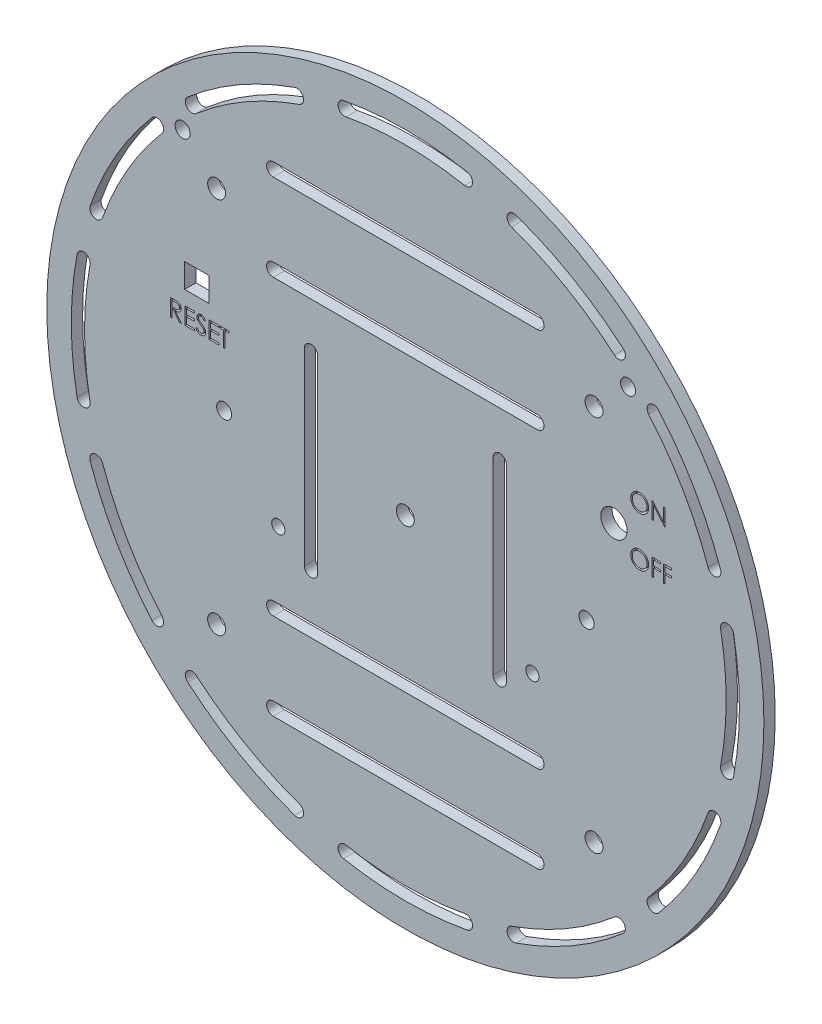
from build123d import *

# Parameters (mm, degrees)
CROQUIS1_R              = 2
CROQUIS1_R_2            = 2.375
CROQUIS1_R_3            = 3.5
CROQUIS1_R_4            = 1.75
CROQUIS1_W              = 6.4
CROQUIS1_H              = 6.4
SALIENTE_EXTRUIR1_DEPTH = 3
CORTAR_EXTRUIR2_DEPTH   = 2


with BuildPart() as part:
    # Croquis1 → Saliente-Extruir1 (new body)
    with BuildSketch(Plane.XY):
        with BuildLine():
            ThreePointArc((-73.654599313, -60), (0, -95), (73.654599313, -60))
            ThreePointArc((73.654599313, -60), (91.058534397, -27.080312284), (94.472218138, 10))
            ThreePointArc((94.472218138, 10), (0, 95), (-94.472218138, 10))
            ThreePointArc((-94.472218138, 10), (-91.058534397, -27.080312284), (-73.654599313, -60))
        make_face()
        with Locations((-59, 59)):
            Circle(CROQUIS1_R, mode=Mode.SUBTRACT)
        with Locations((-50, 50)):
            Circle(CROQUIS1_R_2, mode=Mode.SUBTRACT)
        with Locations(Location((-50, -50, 0), (0, 0, 180))):
            Circle(CROQUIS1_R_2, mode=Mode.SUBTRACT)
        with Locations((50, -50)):
            Circle(CROQUIS1_R_2, mode=Mode.SUBTRACT)
        with Locations(Location((50, 50, 0), (0, 0, 180))):
            Circle(CROQUIS1_R_2, mode=Mode.SUBTRACT)
        with Locations((55.271786123, 25.793259912)):
            Circle(CROQUIS1_R_3, mode=Mode.SUBTRACT)
        with Locations((48, 0)):
            Circle(CROQUIS1_R, mode=Mode.SUBTRACT)
        with Locations(Location((-48, 0, 0), (0, 0, 180))):
            Circle(CROQUIS1_R, mode=Mode.SUBTRACT)
        with Locations((33.654013645, -19.430153837)):
            Circle(CROQUIS1_R_4, mode=Mode.SUBTRACT)
        with Locations((-33.654013645, -19.430153837)):
            Circle(CROQUIS1_R_4, mode=Mode.SUBTRACT)
        Circle(CROQUIS1_R_2, mode=Mode.SUBTRACT)
        with Locations(Location((59, 59, 0), (0, 0, 180))):
            Circle(CROQUIS1_R, mode=Mode.SUBTRACT)
        with BuildLine():
            Line((25, 60.110307675), (35, 60.110307675))
            ThreePointArc((35, 60.110307675), (36.75, 61.860307675), (35, 63.610307675))
            Line((35, 63.610307675), (-35, 63.610307675))
            ThreePointArc((-35, 63.610307675), (-36.75, 61.860307675), (-35, 60.110307675))
            Line((-35, 60.110307675), (19, 60.110307675))
            Line((19, 60.110307675), (25, 60.110307675))
        make_face(mode=Mode.SUBTRACT)
        with BuildLine():
            Line((25, -40.610307675), (35, -40.610307675))
            ThreePointArc((35, -40.610307675), (36.75, -38.860307675), (35, -37.110307675))
            Line((35, -37.110307675), (-35, -37.110307675))
            ThreePointArc((-35, -37.110307675), (-36.75, -38.860307675), (-35, -40.610307675))
            Line((-35, -40.610307675), (19, -40.610307675))
            Line((19, -40.610307675), (25, -40.610307675))
        make_face(mode=Mode.SUBTRACT)
        with BuildLine():
            Line((-35, -60.110307675), (19, -60.110307675))
            Line((19, -60.110307675), (25, -60.110307675))
            Line((25, -60.110307675), (35, -60.110307675))
            ThreePointArc((35, -60.110307675), (36.75, -61.860307675), (35, -63.610307675))
            Line((35, -63.610307675), (-35, -63.610307675))
            ThreePointArc((-35, -63.610307675), (-36.75, -61.860307675), (-35, -60.110307675))
        make_face(mode=Mode.SUBTRACT)
        with BuildLine():
            Line((-26.75, -25), (-26.75, 25))
            ThreePointArc((-26.75, 25), (-25, 26.75), (-23.25, 25))
            Line((-23.25, 25), (-23.25, -25))
            ThreePointArc((-23.25, -25), (-25, -26.75), (-26.75, -25))
        make_face(mode=Mode.SUBTRACT)
        with BuildLine():
            Line((26.75, -25), (26.75, 25))
            ThreePointArc((26.75, 25), (25, 26.75), (23.25, 25))
            Line((23.25, 25), (23.25, -25))
            ThreePointArc((23.25, -25), (25, -26.75), (26.75, -25))
        make_face(mode=Mode.SUBTRACT)
        with BuildLine():
            Line((-35, 40.610307675), (19, 40.610307675))
            Line((19, 40.610307675), (25, 40.610307675))
            Line((25, 40.610307675), (35, 40.610307675))
            ThreePointArc((35, 40.610307675), (36.75, 38.860307675), (35, 37.110307675))
            Line((35, 37.110307675), (-35, 37.110307675))
            ThreePointArc((-35, 37.110307675), (-36.75, 38.860307675), (-35, 40.610307675))
        make_face(mode=Mode.SUBTRACT)
        with Locations((-55.271786123, 25.793259912)):
            Rectangle(CROQUIS1_W, CROQUIS1_H, mode=Mode.SUBTRACT)
        with BuildLine():
            ThreePointArc((28.133023412, 80.209307401), (27.060864624, 82.4398848), (29.291442023, 83.512043588))
            ThreePointArc((29.291442023, 83.512043588), (44.25, 76.643248235), (57.677830258, 67.123154699))
            ThreePointArc((57.677830258, 67.123154699), (57.86460221, 64.655338612), (55.396786123, 64.46856666))
            ThreePointArc((55.396786123, 64.46856666), (42.5, 73.612159322), (28.133023412, 80.209307401))
        make_face(mode=Mode.SUBTRACT)
        with BuildLine():
            ThreePointArc((64.46856666, 55.396786123), (64.655338612, 57.86460221), (67.123154699, 57.677830258))
            ThreePointArc((67.123154699, 57.677830258), (76.643248235, 44.25), (83.512043588, 29.291442023))
            ThreePointArc((83.512043588, 29.291442023), (82.4398848, 27.060864624), (80.209307401, 28.133023412))
            ThreePointArc((80.209307401, 28.133023412), (73.612159322, 42.5), (64.46856666, 55.396786123))
        make_face(mode=Mode.SUBTRACT)
        with BuildLine():
            ThreePointArc((83.529809535, 15.740740741), (84.925466834, 17.784546188), (86.96927228, 16.388888889))
            ThreePointArc((86.96927228, 16.388888889), (88.5, 0), (86.96927228, -16.388888889))
            ThreePointArc((86.96927228, -16.388888889), (84.925466834, -17.784546188), (83.529809535, -15.740740741))
            ThreePointArc((83.529809535, -15.740740741), (85, 0), (83.529809535, 15.740740741))
        make_face(mode=Mode.SUBTRACT)
        with BuildLine():
            ThreePointArc((80.209307401, -28.133023412), (82.4398848, -27.060864624), (83.512043588, -29.291442023))
            ThreePointArc((83.512043588, -29.291442023), (76.643248235, -44.25), (67.123154699, -57.677830258))
            ThreePointArc((67.123154699, -57.677830258), (64.655338612, -57.86460221), (64.46856666, -55.396786123))
            ThreePointArc((64.46856666, -55.396786123), (73.612159322, -42.5), (80.209307401, -28.133023412))
        make_face(mode=Mode.SUBTRACT)
        with BuildLine():
            ThreePointArc((55.396786123, -64.46856666), (57.86460221, -64.655338612), (57.677830258, -67.123154699))
            ThreePointArc((57.677830258, -67.123154699), (44.25, -76.643248235), (29.291442023, -83.512043588))
            ThreePointArc((29.291442023, -83.512043588), (27.060864624, -82.4398848), (28.133023412, -80.209307401))
            ThreePointArc((28.133023412, -80.209307401), (42.5, -73.612159322), (55.396786123, -64.46856666))
        make_face(mode=Mode.SUBTRACT)
        with BuildLine():
            ThreePointArc((15.740740741, -83.529809535), (17.784546188, -84.925466834), (16.388888889, -86.96927228))
            ThreePointArc((16.388888889, -86.96927228), (0, -88.5), (-16.388888889, -86.96927228))
            ThreePointArc((-16.388888889, -86.96927228), (-17.784546188, -84.925466834), (-15.740740741, -83.529809535))
            ThreePointArc((-15.740740741, -83.529809535), (0, -85), (15.740740741, -83.529809535))
        make_face(mode=Mode.SUBTRACT)
        with BuildLine():
            ThreePointArc((-28.133023412, -80.209307401), (-27.060864624, -82.4398848), (-29.291442023, -83.512043588))
            ThreePointArc((-29.291442023, -83.512043588), (-44.25, -76.643248235), (-57.677830258, -67.123154699))
            ThreePointArc((-57.677830258, -67.123154699), (-57.86460221, -64.655338612), (-55.396786123, -64.46856666))
            ThreePointArc((-55.396786123, -64.46856666), (-42.5, -73.612159322), (-28.133023412, -80.209307401))
        make_face(mode=Mode.SUBTRACT)
        with BuildLine():
            ThreePointArc((-64.46856666, -55.396786123), (-64.655338612, -57.86460221), (-67.123154699, -57.677830258))
            ThreePointArc((-67.123154699, -57.677830258), (-76.643248235, -44.25), (-83.512043588, -29.291442023))
            ThreePointArc((-83.512043588, -29.291442023), (-82.4398848, -27.060864624), (-80.209307401, -28.133023412))
            ThreePointArc((-80.209307401, -28.133023412), (-73.612159322, -42.5), (-64.46856666, -55.396786123))
        make_face(mode=Mode.SUBTRACT)
        with BuildLine():
            ThreePointArc((-83.529809535, -15.740740741), (-84.925466834, -17.784546188), (-86.96927228, -16.388888889))
            ThreePointArc((-86.96927228, -16.388888889), (-88.5, 0), (-86.96927228, 16.388888889))
            ThreePointArc((-86.96927228, 16.388888889), (-84.925466834, 17.784546188), (-83.529809535, 15.740740741))
            ThreePointArc((-83.529809535, 15.740740741), (-85, 0), (-83.529809535, -15.740740741))
        make_face(mode=Mode.SUBTRACT)
        with BuildLine():
            ThreePointArc((-80.209307401, 28.133023412), (-82.4398848, 27.060864624), (-83.512043588, 29.291442023))
            ThreePointArc((-83.512043588, 29.291442023), (-76.643248235, 44.25), (-67.123154699, 57.677830258))
            ThreePointArc((-67.123154699, 57.677830258), (-64.655338612, 57.86460221), (-64.46856666, 55.396786123))
            ThreePointArc((-64.46856666, 55.396786123), (-73.612159322, 42.5), (-80.209307401, 28.133023412))
        make_face(mode=Mode.SUBTRACT)
        with BuildLine():
            ThreePointArc((-55.396786123, 64.46856666), (-57.86460221, 64.655338612), (-57.677830258, 67.123154699))
            ThreePointArc((-57.677830258, 67.123154699), (-44.25, 76.643248235), (-29.291442023, 83.512043588))
            ThreePointArc((-29.291442023, 83.512043588), (-27.060864624, 82.4398848), (-28.133023412, 80.209307401))
            ThreePointArc((-28.133023412, 80.209307401), (-42.5, 73.612159322), (-55.396786123, 64.46856666))
        make_face(mode=Mode.SUBTRACT)
        with BuildLine():
            ThreePointArc((-15.740740741, 83.529809535), (-17.784546188, 84.925466834), (-16.388888889, 86.96927228))
            ThreePointArc((-16.388888889, 86.96927228), (0, 88.5), (16.388888889, 86.96927228))
            ThreePointArc((16.388888889, 86.96927228), (17.784546188, 84.925466834), (15.740740741, 83.529809535))
            ThreePointArc((15.740740741, 83.529809535), (0, 85), (-15.740740741, 83.529809535))
        make_face(mode=Mode.SUBTRACT)
    extrude(amount=SALIENTE_EXTRUIR1_DEPTH)

    # Croquis2 → Cortar-Extruir2 (cut)
    # profile 1 of 10: a face of its own
    with BuildSketch(Plane.XY.offset(3)):
        with BuildLine():
            add(Edge.make_bspline(
                [(62.05099301, 36.246698779), (62.134317718, 36.244588306), (62.297974318, 36.240443162), (62.538499186, 36.208712886), (62.768121452, 36.153818813), (62.98871163, 36.080709264), (63.197631172, 35.983182197), (63.396452605, 35.865301292), (63.584702871, 35.725831559), (63.759844647, 35.565851125), (63.920117869, 35.391786684), (64.06132258, 35.206029371), (64.179662672, 35.009702339), (64.276844398, 34.803395557), (64.353085468, 34.587575598), (64.405695667, 34.361091881), (64.43930186, 34.12541185), (64.443230717, 33.964663024), (64.445223779, 33.883117048)],
                knots=[0, 0, 0, 0, 1.065120563, 2.091984664, 3.0946048, 4.079830382, 5.057816894, 6.036188127, 7.030412546, 8.04752943, 9.064399622, 10.05169764, 11.02544977, 11.989514704, 12.962713494, 13.945757189, 14.957906945, 16, 16, 16, 16], degree=3))
            add(Edge.make_bspline(
                [(64.445223779, 33.883117048), (64.443231009, 33.80217176), (64.439303027, 33.64261922), (64.405657456, 33.408434791), (64.352890456, 33.183318182), (64.2775524, 32.967645199), (64.180833928, 32.761188332), (64.06170585, 32.56449082), (63.921381437, 32.377488179), (63.761686914, 32.202229038), (63.58759986, 32.041518004), (63.400875231, 31.90147945), (63.205712391, 31.780977004), (62.999599909, 31.684826566), (62.78527129, 31.607976954), (62.560808304, 31.555580715), (62.327262734, 31.521783088), (62.168000015, 31.517902139), (62.087050702, 31.515929548)],
                knots=[0, 0, 0, 0, 1.043624062, 2.057103931, 3.04512605, 4.022047818, 4.998200453, 5.980619268, 6.982898556, 8.009068085, 9.034988726, 10.034168286, 11.015286542, 11.987931943, 12.962482838, 13.94673481, 14.956375938, 16, 16, 16, 16], degree=3))
            add(Edge.make_bspline(
                [(62.087050702, 31.515929548), (62.005505149, 31.517921617), (61.844757157, 31.521848515), (61.608780969, 31.555510321), (61.382138155, 31.60814914), (61.165476847, 31.683375558), (60.958676223, 31.780597712), (60.761331831, 31.899146199), (60.574235785, 32.039812524), (60.398939253, 32.199455263), (60.238547427, 32.373247258), (60.098713944, 32.559462729), (59.980138798, 32.754448316), (59.883243085, 32.958745133), (59.806531637, 33.171365559), (59.754196871, 33.393727887), (59.720336361, 33.624564395), (59.716434416, 33.781733835), (59.714454548, 33.861482433)],
                knots=[0, 0, 0, 0, 1.053102029, 2.075944431, 3.073151272, 4.055350789, 5.033113405, 6.020478099, 7.024410459, 8.052272461, 9.079885166, 10.07527673, 11.055994387, 12.023226415, 12.992069828, 13.970394897, 14.97016774, 16, 16, 16, 16], degree=3))
            add(Edge.make_bspline(
                [(59.714454548, 33.861482433), (59.715141937, 33.91501015), (59.716508042, 34.021390309), (59.732954504, 34.179361652), (59.756819548, 34.334792498), (59.791022007, 34.48724086), (59.835754151, 34.636333554), (59.888535329, 34.783098821), (59.953000844, 34.926049323), (60.025875963, 35.065862255), (60.107212573, 35.200358134), (60.197052823, 35.327489026), (60.292241154, 35.448321737), (60.396594088, 35.559725027), (60.506672375, 35.664939728), (60.624261718, 35.762348936), (60.748644604, 35.852831016), (60.880356235, 35.934371454), (61.01615116, 36.008118913), (61.156135588, 36.07140415), (61.298408323, 36.125720515), (61.443635728, 36.169744433), (61.591432149, 36.204499908), (61.742120158, 36.228166505), (61.895579706, 36.244654914), (61.998965687, 36.246014559), (62.05099301, 36.246698779)],
                knots=[0, 0, 0, 0, 1.037015668, 2.060948919, 3.074880161, 4.083647147, 5.086022904, 6.090072063, 7.104153813, 8.122640571, 9.144368836, 10.147691507, 11.138137339, 12.123020368, 13.103399296, 14.087645067, 15.080126199, 16.082011238, 17.087798457, 18.072939717, 19.057185487, 20.037253025, 21.01195951, 21.997135196, 22.992090687, 24, 24, 24, 24], degree=3))
        make_face()
        with BuildLine():
            add(Edge.make_bspline(
                [(62.070824741, 35.785160317), (62.028120212, 35.784639744), (61.943119412, 35.783603575), (61.81675358, 35.769954797), (61.692049665, 35.750502083), (61.568981914, 35.722754414), (61.448065256, 35.684949203), (61.328172603, 35.641439464), (61.210397248, 35.588440919), (61.095128002, 35.528561727), (60.983380048, 35.462284543), (60.877935147, 35.389035129), (60.778520319, 35.310531273), (60.685378976, 35.226589768), (60.598784612, 35.136783137), (60.517032853, 35.042472862), (60.443400533, 34.940963288), (60.375919077, 34.835007051), (60.315531854, 34.72474216), (60.261833541, 34.61132948), (60.217908387, 34.493843883), (60.182085332, 34.373559966), (60.152385575, 34.250668232), (60.13357053, 34.124236427), (60.119771782, 33.994899854), (60.118794838, 33.907494613), (60.118300702, 33.863285317)],
                knots=[0, 0, 0, 0, 1.008559885, 2.007477868, 2.99961109, 3.989939068, 4.984837346, 5.991145699, 7.001802488, 8.033829008, 9.059044045, 10.069351652, 11.065060232, 12.050310815, 13.029377138, 14.011219647, 14.996725999, 15.989392538, 16.977580475, 17.965360261, 18.951710183, 19.937753436, 20.929683414, 21.935841486, 22.955955122, 24, 24, 24, 24], degree=3))
            add(Edge.make_bspline(
                [(60.118300702, 33.863285317), (60.11993981, 33.798276748), (60.123164443, 33.67038478), (60.151395605, 33.482968595), (60.194881001, 33.302855084), (60.258983329, 33.131029772), (60.339148405, 32.966015695), (60.438182978, 32.809276703), (60.555516088, 32.660770436), (60.688797765, 32.521533661), (60.834498388, 32.394446199), (60.989211898, 32.282893245), (61.151280822, 32.188508638), (61.321127797, 32.111616402), (61.497846061, 32.050686739), (61.682574341, 32.008928499), (61.874082075, 31.981445771), (62.004621489, 31.978806513), (62.070824741, 31.97746801)],
                knots=[0, 0, 0, 0, 1.032063989, 2.030389145, 3.003944642, 3.970395727, 4.937377036, 5.913328081, 6.909231446, 7.93887556, 8.970685674, 9.976071282, 10.964166581, 11.944589148, 12.933237628, 13.927779006, 14.949070134, 16, 16, 16, 16], degree=3))
            add(Edge.make_bspline(
                [(62.070824741, 31.97746801), (62.115322671, 31.978079373), (62.203575432, 31.979291889), (62.334841104, 31.991504473), (62.463741948, 32.011088305), (62.590097165, 32.039284862), (62.713763351, 32.074574128), (62.835256669, 32.116498349), (62.953283042, 32.168802754), (63.069331405, 32.226592978), (63.180412287, 32.29247318), (63.286452257, 32.363236515), (63.384778517, 32.441624742), (63.47785018, 32.524319072), (63.564800066, 32.612986877), (63.645040189, 32.707512876), (63.718300359, 32.808493721), (63.78575619, 32.914289243), (63.845931814, 33.024855854), (63.898362084, 33.138679725), (63.942842804, 33.25548058), (63.978750882, 33.375426886), (64.006889333, 33.498290835), (64.026277801, 33.624236935), (64.039840079, 33.753013233), (64.040862321, 33.840112476), (64.041377625, 33.884018491)],
                knots=[0, 0, 0, 0, 1.047197238, 2.076906641, 3.100256066, 4.114471768, 5.12198147, 6.126382909, 7.136867548, 8.15857795, 9.17633901, 10.174870724, 11.156907918, 12.133735059, 13.104061851, 14.077631395, 15.04955518, 16.038496417, 17.029181396, 18.010275684, 18.986308667, 19.968651475, 20.955262928, 21.950658345, 22.966943676, 24, 24, 24, 24], degree=3))
            add(Edge.make_bspline(
                [(64.041377625, 33.884018491), (64.040861909, 33.927624139), (64.03983889, 34.014123975), (64.026284279, 34.14200217), (64.006868849, 34.267042013), (63.978888224, 34.388752617), (63.942823741, 34.507165006), (63.898354316, 34.622167968), (63.845916074, 34.734189933), (63.785734071, 34.842954029), (63.718085155, 34.947321549), (63.644163985, 35.04709608), (63.562694252, 35.14040389), (63.476003649, 35.229548497), (63.381926796, 35.31262864), (63.280889846, 35.389671881), (63.174119404, 35.46253752), (63.061070101, 35.528270385), (62.944399303, 35.588974398), (62.824681357, 35.640982831), (62.703272515, 35.685175556), (62.580481513, 35.722868797), (62.455274827, 35.750393407), (62.328498476, 35.769972328), (62.200327857, 35.783598824), (62.114129432, 35.784638168), (62.070824741, 35.785160317)],
                knots=[0, 0, 0, 0, 1.02996197, 2.043119294, 3.035359645, 4.018872909, 4.991431989, 5.957985074, 6.929999688, 7.912076566, 8.892894881, 9.867085534, 10.843653904, 11.817741046, 12.803660682, 13.806313499, 14.818574707, 15.856120519, 16.894564902, 17.924820532, 18.937903209, 19.946497019, 20.957711757, 21.963978472, 22.977135795, 24, 24, 24, 24], degree=3))
        make_face(mode=Mode.SUBTRACT)
    # profile 2 of 10: a face of its own
    with BuildSketch(Plane.XY.offset(3)):
        Polygon((65.368300702, 31.631314164), (65.368300702, 36.131314164), (65.453036279, 36.131314164), (68.42599301, 32.589547337), (68.42599301, 36.131314164), (68.829839164, 36.131314164), (68.829839164, 31.631314164), (68.737892048, 31.631314164), (65.772146856, 35.16496801), (65.772146856, 31.631314164), align=None)
    # profile 3 of 10: a face of its own
    with BuildSketch(Plane.XY.offset(3)):
        with BuildLine():
            add(Edge.make_bspline(
                [(62.05099301, 23.210322144), (62.134317718, 23.208211671), (62.297974318, 23.204066527), (62.538499186, 23.172336251), (62.768121452, 23.117442178), (62.98871163, 23.044332629), (63.197631172, 22.946805562), (63.396452605, 22.828924657), (63.584702871, 22.689454924), (63.759844647, 22.52947449), (63.920117869, 22.355410049), (64.06132258, 22.169652736), (64.179662672, 21.973325705), (64.276844398, 21.767018922), (64.353085468, 21.551198963), (64.405695667, 21.324715246), (64.43930186, 21.089035216), (64.443230717, 20.92828639), (64.445223779, 20.846740413)],
                knots=[0, 0, 0, 0, 1.065120563, 2.091984664, 3.0946048, 4.079830382, 5.057816894, 6.036188127, 7.030412546, 8.04752943, 9.064399622, 10.05169764, 11.02544977, 11.989514704, 12.962713494, 13.945757189, 14.957906945, 16, 16, 16, 16], degree=3))
            add(Edge.make_bspline(
                [(64.445223779, 20.846740413), (64.443231009, 20.765795125), (64.439303027, 20.606242585), (64.405657456, 20.372058156), (64.352890456, 20.146941547), (64.2775524, 19.931268565), (64.180833928, 19.724811697), (64.06170585, 19.528114185), (63.921381437, 19.341111544), (63.761686914, 19.165852403), (63.58759986, 19.005141369), (63.400875231, 18.865102815), (63.205712391, 18.744600369), (62.999599909, 18.648449931), (62.78527129, 18.571600319), (62.560808304, 18.51920408), (62.327262734, 18.485406453), (62.168000015, 18.481525504), (62.087050702, 18.479552913)],
                knots=[0, 0, 0, 0, 1.043624062, 2.057103931, 3.04512605, 4.022047818, 4.998200453, 5.980619268, 6.982898556, 8.009068085, 9.034988726, 10.034168286, 11.015286542, 11.987931943, 12.962482838, 13.94673481, 14.956375938, 16, 16, 16, 16], degree=3))
            add(Edge.make_bspline(
                [(62.087050702, 18.479552913), (62.005505149, 18.481544982), (61.844757157, 18.48547188), (61.608780969, 18.519133686), (61.382138155, 18.571772505), (61.165476847, 18.646998923), (60.958676223, 18.744221077), (60.761331831, 18.862769565), (60.574235785, 19.003435889), (60.398939253, 19.163078628), (60.238547427, 19.336870623), (60.098713944, 19.523086094), (59.980138798, 19.718071681), (59.883243085, 19.922368498), (59.806531637, 20.134988924), (59.754196871, 20.357351252), (59.720336361, 20.58818776), (59.716434416, 20.745357201), (59.714454548, 20.825105798)],
                knots=[0, 0, 0, 0, 1.053102029, 2.075944431, 3.073151272, 4.055350789, 5.033113405, 6.020478099, 7.024410459, 8.052272461, 9.079885166, 10.07527673, 11.055994387, 12.023226415, 12.992069828, 13.970394897, 14.97016774, 16, 16, 16, 16], degree=3))
            add(Edge.make_bspline(
                [(59.714454548, 20.825105798), (59.715141937, 20.878633515), (59.716508042, 20.985013674), (59.732954504, 21.142985017), (59.756819548, 21.298415863), (59.791022007, 21.450864225), (59.835754151, 21.599956919), (59.888535329, 21.746722186), (59.953000844, 21.889672688), (60.025875963, 22.02948562), (60.107212573, 22.163981499), (60.197052823, 22.291112392), (60.292241154, 22.411945102), (60.396594088, 22.523348392), (60.506672375, 22.628563093), (60.624261718, 22.725972301), (60.748644604, 22.816454381), (60.880356235, 22.897994819), (61.01615116, 22.971742278), (61.156135588, 23.035027515), (61.298408323, 23.08934388), (61.443635728, 23.133367798), (61.591432149, 23.168123273), (61.742120158, 23.19178987), (61.895579706, 23.208278279), (61.998965687, 23.209637925), (62.05099301, 23.210322144)],
                knots=[0, 0, 0, 0, 1.037015668, 2.060948919, 3.074880161, 4.083647147, 5.086022904, 6.090072063, 7.104153813, 8.122640571, 9.144368836, 10.147691507, 11.138137339, 12.123020368, 13.103399296, 14.087645067, 15.080126199, 16.082011238, 17.087798457, 18.072939717, 19.057185487, 20.037253025, 21.01195951, 21.997135196, 22.992090687, 24, 24, 24, 24], degree=3))
        make_face()
        with BuildLine():
            add(Edge.make_bspline(
                [(62.070824741, 22.748783683), (62.028120212, 22.748263109), (61.943119412, 22.74722694), (61.81675358, 22.733578163), (61.692049665, 22.714125448), (61.568981914, 22.686377779), (61.448065256, 22.648572568), (61.328172603, 22.605062829), (61.210397248, 22.552064284), (61.095128002, 22.492185092), (60.983380048, 22.425907909), (60.877935147, 22.352658494), (60.778520319, 22.274154638), (60.685378976, 22.190213133), (60.598784612, 22.100406502), (60.517032853, 22.006096227), (60.443400533, 21.904586653), (60.375919077, 21.798630416), (60.315531854, 21.688365526), (60.261833541, 21.574952846), (60.217908387, 21.457467248), (60.182085332, 21.337183331), (60.152385575, 21.214291597), (60.13357053, 21.087859792), (60.119771782, 20.958523219), (60.118794838, 20.871117978), (60.118300702, 20.826908683)],
                knots=[0, 0, 0, 0, 1.008559885, 2.007477868, 2.99961109, 3.989939068, 4.984837346, 5.991145699, 7.001802488, 8.033829008, 9.059044045, 10.069351652, 11.065060232, 12.050310815, 13.029377138, 14.011219647, 14.996725999, 15.989392538, 16.977580475, 17.965360261, 18.951710183, 19.937753436, 20.929683414, 21.935841486, 22.955955122, 24, 24, 24, 24], degree=3))
            add(Edge.make_bspline(
                [(60.118300702, 20.826908683), (60.11993981, 20.761900113), (60.123164443, 20.634008146), (60.151395605, 20.446591961), (60.194881001, 20.26647845), (60.258983329, 20.094653138), (60.339148405, 19.92963906), (60.438182978, 19.772900068), (60.555516088, 19.624393801), (60.688797765, 19.485157026), (60.834498388, 19.358069564), (60.989211898, 19.24651661), (61.151280822, 19.152132003), (61.321127797, 19.075239767), (61.497846061, 19.014310104), (61.682574341, 18.972551864), (61.874082075, 18.945069136), (62.004621489, 18.942429878), (62.070824741, 18.941091375)],
                knots=[0, 0, 0, 0, 1.032063989, 2.030389145, 3.003944642, 3.970395727, 4.937377036, 5.913328081, 6.909231446, 7.93887556, 8.970685674, 9.976071282, 10.964166581, 11.944589148, 12.933237628, 13.927779006, 14.949070134, 16, 16, 16, 16], degree=3))
            add(Edge.make_bspline(
                [(62.070824741, 18.941091375), (62.115322671, 18.941702738), (62.203575432, 18.942915254), (62.334841104, 18.955127838), (62.463741948, 18.97471167), (62.590097165, 19.002908227), (62.713763351, 19.038197493), (62.835256669, 19.080121715), (62.953283042, 19.132426119), (63.069331405, 19.190216343), (63.180412287, 19.256096545), (63.286452257, 19.326859881), (63.384778517, 19.405248107), (63.47785018, 19.487942438), (63.564800066, 19.576610242), (63.645040189, 19.671136241), (63.718300359, 19.772117087), (63.78575619, 19.877912608), (63.845931814, 19.988479219), (63.898362084, 20.10230309), (63.942842804, 20.219103945), (63.978750882, 20.339050252), (64.006889333, 20.4619142), (64.026277801, 20.5878603), (64.039840079, 20.716636598), (64.040862321, 20.803735841), (64.041377625, 20.847641856)],
                knots=[0, 0, 0, 0, 1.047197238, 2.076906641, 3.100256066, 4.114471768, 5.12198147, 6.126382909, 7.136867548, 8.15857795, 9.17633901, 10.174870724, 11.156907918, 12.133735059, 13.104061851, 14.077631395, 15.04955518, 16.038496417, 17.029181396, 18.010275684, 18.986308667, 19.968651475, 20.955262928, 21.950658345, 22.966943676, 24, 24, 24, 24], degree=3))
            add(Edge.make_bspline(
                [(64.041377625, 20.847641856), (64.040861909, 20.891247504), (64.03983889, 20.97774734), (64.026284279, 21.105625535), (64.006868849, 21.230665378), (63.978888224, 21.352375982), (63.942823741, 21.470788372), (63.898354316, 21.585791333), (63.845916074, 21.697813298), (63.785734071, 21.806577394), (63.718085155, 21.910944914), (63.644163985, 22.010719445), (63.562694252, 22.104027255), (63.476003649, 22.193171862), (63.381926796, 22.276252005), (63.280889846, 22.353295246), (63.174119404, 22.426160885), (63.061070101, 22.49189375), (62.944399303, 22.552597763), (62.824681357, 22.604606196), (62.703272515, 22.648798921), (62.580481513, 22.686492162), (62.455274827, 22.714016772), (62.328498476, 22.733595693), (62.200327857, 22.747222189), (62.114129432, 22.748261533), (62.070824741, 22.748783683)],
                knots=[0, 0, 0, 0, 1.02996197, 2.043119294, 3.035359645, 4.018872909, 4.991431989, 5.957985074, 6.929999688, 7.912076566, 8.892894881, 9.867085534, 10.843653904, 11.817741046, 12.803660682, 13.806313499, 14.818574707, 15.856120519, 16.894564902, 17.924820532, 18.937903209, 19.946497019, 20.957711757, 21.963978472, 22.977135795, 24, 24, 24, 24], degree=3))
        make_face(mode=Mode.SUBTRACT)
    # profile 4 of 10: a face of its own
    with BuildSketch(Plane.XY.offset(3)):
        Polygon((65.368300702, 23.094937529), (67.560608395, 23.094937529), (67.560608395, 22.633399067), (65.772146856, 22.633399067), (65.772146856, 21.248783683), (67.560608395, 21.248783683), (67.560608395, 20.787245221), (65.772146856, 20.787245221), (65.772146856, 18.594937529), (65.368300702, 18.594937529), align=None)
    # profile 5 of 10: a face of its own
    with BuildSketch(Plane.XY.offset(3)):
        Polygon((68.368300702, 23.094937529), (70.560608395, 23.094937529), (70.560608395, 22.633399067), (68.772146856, 22.633399067), (68.772146856, 21.248783683), (70.560608395, 21.248783683), (70.560608395, 20.787245221), (68.772146856, 20.787245221), (68.772146856, 18.594937529), (68.368300702, 18.594937529), align=None)
    # profile 6 of 10: a face of its own
    with BuildSketch(Plane.XY.offset(3)):
        with BuildLine():
            Line((-62.229637153, 18.868758653), (-61.329096288, 18.868758653))
            add(Edge.make_bspline(
                [(-61.329096288, 18.868758653), (-61.269000551, 18.868558614), (-61.15361008, 18.868174517), (-60.988301589, 18.866032821), (-60.838095322, 18.859894364), (-60.703069814, 18.8546119), (-60.583227543, 18.844979404), (-60.478201027, 18.835772857), (-60.388473987, 18.823721008), (-60.334157893, 18.812528321), (-60.309565038, 18.807460576)],
                knots=[0, 0, 0, 0, 1.410062039, 2.707475311, 3.878576406, 4.937260626, 5.877586885, 6.699081471, 7.410979367, 8, 8, 8, 8], degree=3))
            add(Edge.make_bspline(
                [(-60.309565038, 18.807460576), (-60.276642235, 18.799326163), (-60.211498963, 18.783230867), (-60.117706021, 18.749211381), (-60.028330462, 18.709843292), (-59.943743545, 18.663604223), (-59.864368956, 18.610150935), (-59.789388271, 18.550406206), (-59.718461246, 18.484696941), (-59.654456293, 18.411366431), (-59.594106084, 18.334433775), (-59.543206421, 18.251243231), (-59.499329519, 18.164249838), (-59.464395997, 18.072568873), (-59.436267174, 17.977089452), (-59.416433438, 17.876946713), (-59.404539054, 17.772596888), (-59.403328096, 17.701422434), (-59.402714076, 17.665333172)],
                knots=[0, 0, 0, 0, 1.027469482, 2.033020251, 3.019912614, 3.986113645, 4.951240523, 5.91722682, 6.890402269, 7.87763091, 8.8651537, 9.85103654, 10.82876324, 11.815024772, 12.821070561, 13.842952187, 14.906261191, 16, 16, 16, 16], degree=3))
            add(Edge.make_bspline(
                [(-59.402714076, 17.665333172), (-59.404602788, 17.605373752), (-59.408288154, 17.488377393), (-59.442649002, 17.318584832), (-59.498933099, 17.16019857), (-59.576491613, 17.013418035), (-59.67525951, 16.881104348), (-59.793962813, 16.764888049), (-59.932667742, 16.667636733), (-60.061791148, 16.600197412), (-60.175852262, 16.55700653), (-60.269752236, 16.526616926), (-60.372181207, 16.503137256), (-60.48215778, 16.482102801), (-60.600139623, 16.466222051), (-60.725843959, 16.454590715), (-60.85936044, 16.447321224), (-60.9510821, 16.446238646), (-60.998266961, 16.44568173)],
                knots=[0, 0, 0, 0, 1.260483769, 2.459530307, 3.627416485, 4.787058657, 5.939039949, 7.08810263, 8.267026773, 9.491475466, 10.141966685, 10.831826277, 11.566392101, 12.351337768, 13.187381173, 14.07005841, 15.007169909, 16, 16, 16, 16], degree=3))
            Line((-60.998266961, 16.44568173), (-59.345021769, 14.368758653))
            Line((-59.345021769, 14.368758653), (-59.844420807, 14.368758653))
            Line((-59.844420807, 14.368758653), (-61.497665999, 16.44568173))
            Line((-61.497665999, 16.44568173), (-61.825790999, 16.44568173))
            Line((-61.825790999, 16.44568173), (-61.825790999, 14.368758653))
            Line((-61.825790999, 14.368758653), (-62.229637153, 14.368758653))
            Line((-62.229637153, 14.368758653), (-62.229637153, 18.868758653))
        make_face()
        with BuildLine():
            Line((-61.825790999, 18.407220191), (-61.825790999, 16.907220191))
            Line((-61.825790999, 16.907220191), (-61.00187273, 16.900910095))
            add(Edge.make_bspline(
                [(-61.00187273, 16.900910095), (-60.963404109, 16.900893077), (-60.888840964, 16.90086009), (-60.78096868, 16.905994945), (-60.680528537, 16.911836354), (-60.587904713, 16.920771227), (-60.50305583, 16.932286177), (-60.426024299, 16.946690013), (-60.356684375, 16.963471237), (-60.275814826, 16.989444756), (-60.185510714, 17.030595351), (-60.087370265, 17.090465277), (-60.003795831, 17.165768431), (-59.933187151, 17.25187716), (-59.876449311, 17.346552337), (-59.836448098, 17.448659097), (-59.811064958, 17.555619723), (-59.808071114, 17.629134433), (-59.80656023, 17.666234615)],
                knots=[0, 0, 0, 0, 1.146690395, 2.22261258, 3.21895312, 4.145990853, 4.996080663, 5.770904154, 6.481378293, 7.121626537, 8.300444488, 9.431385265, 10.535395872, 11.636531494, 12.74115979, 13.810798291, 14.895190096, 16, 16, 16, 16], degree=3))
            add(Edge.make_bspline(
                [(-59.80656023, 17.666234615), (-59.808105814, 17.702423067), (-59.811168598, 17.774135373), (-59.836174158, 17.879121544), (-59.878460505, 17.978207622), (-59.93544624, 18.070990532), (-60.004873725, 18.155212192), (-60.086282341, 18.227272818), (-60.177446163, 18.286736415), (-60.26265199, 18.324734904), (-60.338810263, 18.348031858), (-60.404934112, 18.364426212), (-60.479648869, 18.377597672), (-60.563317316, 18.388150893), (-60.655582269, 18.397221536), (-60.756910249, 18.403330965), (-60.866628967, 18.406948791), (-60.942675021, 18.407127619), (-60.982040999, 18.407220191)],
                knots=[0, 0, 0, 0, 1.101028733, 2.181837193, 3.264309656, 4.369019818, 5.486613113, 6.575447106, 7.666700264, 8.788928104, 9.402425223, 10.0903467, 10.862060571, 11.710948788, 12.657782767, 13.684531032, 14.801375019, 16, 16, 16, 16], degree=3))
            Line((-60.982040999, 18.407220191), (-61.825790999, 18.407220191))
        make_face(mode=Mode.SUBTRACT)
    # profile 7 of 10: a face of its own
    with BuildSketch(Plane.XY.offset(3)):
        Polygon((-58.421944846, 18.868758653), (-55.883483307, 18.868758653), (-55.883483307, 18.407220191), (-58.018098692, 18.407220191), (-58.018098692, 17.022604807), (-55.883483307, 17.022604807), (-55.883483307, 16.561066345), (-58.018098692, 16.561066345), (-58.018098692, 14.830297115), (-55.883483307, 14.830297115), (-55.883483307, 14.368758653), (-58.421944846, 14.368758653), align=None)
    # profile 8 of 10: a face of its own
    with BuildSketch(Plane.XY.offset(3)):
        with BuildLine():
            Line((-55.537329461, 15.236847595), (-55.156920807, 15.464912499))
            add(Edge.make_bspline(
                [(-55.156920807, 15.464912499), (-55.121540216, 15.405686861), (-55.05375237, 15.292212825), (-54.940672051, 15.138881059), (-54.823501165, 15.008558286), (-54.701372022, 14.902002647), (-54.575030089, 14.818111222), (-54.443650591, 14.758708352), (-54.307676263, 14.721659241), (-54.215138492, 14.71715913), (-54.168940038, 14.714912499)],
                knots=[0, 0, 0, 0, 1.272034388, 2.437168799, 3.508375237, 4.49857839, 5.41946034, 6.295179144, 7.148887113, 8, 8, 8, 8], degree=3))
            add(Edge.make_bspline(
                [(-54.168940038, 14.714912499), (-54.129485503, 14.716011364), (-54.051266795, 14.718189866), (-53.936115339, 14.739122325), (-53.824281594, 14.771280777), (-53.718070488, 14.81733626), (-53.618947555, 14.87305717), (-53.532024661, 14.940359399), (-53.456879658, 15.015710235), (-53.395410797, 15.099773648), (-53.348250751, 15.19018141), (-53.312003806, 15.282979062), (-53.291888712, 15.379624364), (-53.2888586, 15.444694959), (-53.287329461, 15.477532691)],
                knots=[0, 0, 0, 0, 1.095163259, 2.171163733, 3.241058638, 4.321873601, 5.38011039, 6.391990106, 7.366004449, 8.327778327, 9.272591725, 10.192022065, 11.087607919, 12, 12, 12, 12], degree=3))
            add(Edge.make_bspline(
                [(-53.287329461, 15.477532691), (-53.289225003, 15.514999498), (-53.293078364, 15.591164041), (-53.32564741, 15.703535024), (-53.376882156, 15.814739757), (-53.424148412, 15.883527098), (-53.448687634, 15.919239422)],
                knots=[0, 0, 0, 0, 0.938893495, 1.908633276, 2.914225137, 4, 4, 4, 4], degree=3))
            add(Edge.make_bspline(
                [(-53.448687634, 15.919239422), (-53.468835566, 15.94501391), (-53.511133631, 15.999124222), (-53.583850432, 16.079668096), (-53.669178294, 16.162748921), (-53.76419715, 16.251539137), (-53.872368264, 16.341909161), (-53.99030364, 16.438168376), (-54.121014316, 16.536656118), (-54.212685097, 16.602706559), (-54.259985711, 16.636787499)],
                knots=[0, 0, 0, 0, 0.722233717, 1.516239348, 2.393582979, 3.351407094, 4.387010283, 5.505090956, 6.712668013, 8, 8, 8, 8], degree=3))
            add(Edge.make_bspline(
                [(-54.259985711, 16.636787499), (-54.307330849, 16.670509969), (-54.397851147, 16.734984763), (-54.524440753, 16.830673128), (-54.637640777, 16.918158104), (-54.736948084, 16.998263262), (-54.822318994, 17.070999468), (-54.894426237, 17.135668247), (-54.951432953, 17.19401854), (-54.983132986, 17.231871693), (-54.997365519, 17.248866826)],
                knots=[0, 0, 0, 0, 1.452282411, 2.77665338, 3.964542531, 5.026858415, 5.96415736, 6.766646006, 7.446254459, 8, 8, 8, 8], degree=3))
            add(Edge.make_bspline(
                [(-54.997365519, 17.248866826), (-55.017258791, 17.275353873), (-55.056381581, 17.327444207), (-55.108023588, 17.408861881), (-55.151916797, 17.49220608), (-55.18632551, 17.577700763), (-55.215300649, 17.664145671), (-55.234789417, 17.752668701), (-55.246992641, 17.842872639), (-55.248242338, 17.903575712), (-55.248867922, 17.93396298)],
                knots=[0, 0, 0, 0, 1.068054152, 2.10047183, 3.106115577, 4.101338837, 5.06977816, 6.043150881, 7.020423561, 8, 8, 8, 8], degree=3))
            add(Edge.make_bspline(
                [(-55.248867922, 17.93396298), (-55.247189797, 17.98157269), (-55.243869414, 18.075774486), (-55.215788749, 18.213385554), (-55.171466457, 18.34476809), (-55.109373029, 18.468621377), (-55.029327861, 18.581720495), (-54.936697323, 18.685366407), (-54.826368269, 18.772497441), (-54.705314896, 18.84862723), (-54.572813847, 18.908214849), (-54.433968399, 18.95316468), (-54.288557878, 18.978633726), (-54.190068134, 18.982288709), (-54.140093884, 18.984143268)],
                knots=[0, 0, 0, 0, 1.005424448, 1.989358655, 2.955360095, 3.929531133, 4.905563448, 5.876582895, 6.856512386, 7.866279853, 8.892233794, 9.918561126, 10.94386622, 12, 12, 12, 12], degree=3))
            add(Edge.make_bspline(
                [(-54.140093884, 18.984143268), (-54.087065755, 18.982314274), (-53.981609731, 18.978676986), (-53.826489311, 18.947051589), (-53.677139819, 18.894722154), (-53.556998478, 18.835336736), (-53.462970642, 18.776024916), (-53.391262843, 18.721999428), (-53.318597549, 18.65980286), (-53.244388621, 18.589269543), (-53.169893488, 18.509752292), (-53.094006192, 18.421795692), (-53.016549275, 18.325937263), (-52.966720312, 18.257505762), (-52.941175615, 18.222424518)],
                knots=[0, 0, 0, 0, 1.286793592, 2.559021753, 3.825965368, 5.121522368, 5.803751409, 6.523245864, 7.299691795, 8.125521123, 9.008227632, 9.944561021, 10.946284179, 12, 12, 12, 12], degree=3))
            Line((-52.941175615, 18.222424518), (-53.306259749, 17.94568173))
            add(Edge.make_bspline(
                [(-53.306259749, 17.94568173), (-53.32830452, 17.974081475), (-53.370757593, 18.028772743), (-53.43520979, 18.105364435), (-53.495958052, 18.17532848), (-53.555808566, 18.23609793), (-53.611600378, 18.291000673), (-53.665750861, 18.338006075), (-53.717480741, 18.377574697), (-53.782688198, 18.419802132), (-53.864610978, 18.461660493), (-53.967448239, 18.497080737), (-54.074916307, 18.518365816), (-54.148111548, 18.5211801), (-54.185165999, 18.522604807)],
                knots=[0, 0, 0, 0, 1.181633172, 2.275549214, 3.290209073, 4.226197932, 5.078386478, 5.862611352, 6.581680152, 7.217281963, 8.414376989, 9.595101626, 10.782541182, 12, 12, 12, 12], degree=3))
            add(Edge.make_bspline(
                [(-54.185165999, 18.522604807), (-54.231652957, 18.521046907), (-54.321298675, 18.518042644), (-54.448571836, 18.485231234), (-54.563121168, 18.433568842), (-54.661545894, 18.36116387), (-54.743493436, 18.275379737), (-54.802771883, 18.176664066), (-54.838450666, 18.06765812), (-54.842804454, 17.991618847), (-54.845021769, 17.952893268)],
                knots=[0, 0, 0, 0, 1.14458467, 2.207223713, 3.21896685, 4.227309161, 5.202851033, 6.127160689, 7.046193047, 8, 8, 8, 8], degree=3))
            add(Edge.make_bspline(
                [(-54.845021769, 17.952893268), (-54.84451632, 17.928784225), (-54.843504596, 17.880526714), (-54.829394142, 17.809232029), (-54.811266434, 17.738117449), (-54.782540193, 17.6675027), (-54.742881945, 17.59615281), (-54.690803862, 17.522839147), (-54.625215318, 17.446915522), (-54.574973445, 17.397534613), (-54.548447249, 17.37146298)],
                knots=[0, 0, 0, 0, 0.858281714, 1.717966888, 2.583508476, 3.4729293, 4.427298488, 5.488583878, 6.674047936, 8, 8, 8, 8], degree=3))
            add(Edge.make_bspline(
                [(-54.548447249, 17.37146298), (-54.538596913, 17.362672518), (-54.51519477, 17.341788393), (-54.472411437, 17.307598318), (-54.415913553, 17.265423325), (-54.347176438, 17.213239633), (-54.264932687, 17.152706324), (-54.169173257, 17.084597394), (-54.060965572, 17.006701804), (-53.984180252, 16.952242109), (-53.943579461, 16.923446153)],
                knots=[0, 0, 0, 0, 0.420754252, 0.999615792, 1.744751191, 2.668019286, 3.750313428, 4.999500688, 6.413464383, 8, 8, 8, 8], degree=3))
            add(Edge.make_bspline(
                [(-53.943579461, 16.923446153), (-53.89474043, 16.887907262), (-53.800170414, 16.819091126), (-53.665610669, 16.715699537), (-53.543604344, 16.614580977), (-53.433723082, 16.516381197), (-53.334881343, 16.421845077), (-53.248175702, 16.329835274), (-53.172722684, 16.241010966), (-53.091492261, 16.12713194), (-53.00848935, 15.987270546), (-52.937207412, 15.815912811), (-52.892260965, 15.64388897), (-52.886383302, 15.528268752), (-52.883483307, 15.471222595)],
                knots=[0, 0, 0, 0, 1.163667725, 2.253281268, 3.268753668, 4.215851969, 5.092017293, 5.902905408, 6.650798638, 7.335211899, 8.59617414, 9.77448103, 10.901945474, 12, 12, 12, 12], degree=3))
            add(Edge.make_bspline(
                [(-52.883483307, 15.471222595), (-52.884328199, 15.430878983), (-52.886001575, 15.350975204), (-52.905237036, 15.233647248), (-52.933419463, 15.119693273), (-52.975895906, 15.010521843), (-53.027739967, 14.904135719), (-53.093525143, 14.803325562), (-53.16977788, 14.705860192), (-53.257249864, 14.61433856), (-53.352966024, 14.530322022), (-53.454130774, 14.455584658), (-53.560909696, 14.393268242), (-53.672723532, 14.342417159), (-53.789597965, 14.302645494), (-53.911493687, 14.273828948), (-54.03861163, 14.256143034), (-54.125012249, 14.254307341), (-54.168940038, 14.253374038)],
                knots=[0, 0, 0, 0, 0.983748083, 1.948392443, 2.894712957, 3.844097841, 4.80183111, 5.778335162, 6.776009319, 7.81870978, 8.863265674, 9.881300176, 10.883814829, 11.87499822, 12.874611388, 13.892143829, 14.928324115, 16, 16, 16, 16], degree=3))
            add(Edge.make_bspline(
                [(-54.168940038, 14.253374038), (-54.202928336, 14.254031271), (-54.270476885, 14.255337461), (-54.370389076, 14.266884821), (-54.468282833, 14.283222526), (-54.562929767, 14.309160616), (-54.655549296, 14.340631015), (-54.745738598, 14.3793803), (-54.833541381, 14.425816702), (-54.919449702, 14.478910305), (-55.00324507, 14.540698834), (-55.084141528, 14.612664758), (-55.164793338, 14.692823264), (-55.242819991, 14.783351131), (-55.319799748, 14.882785809), (-55.394214846, 14.992057616), (-55.467605626, 15.110571357), (-55.513654084, 15.193969324), (-55.537329461, 15.236847595)],
                knots=[0, 0, 0, 0, 0.915332311, 1.819136955, 2.706846663, 3.586547465, 4.459518054, 5.340707479, 6.227863349, 7.133153174, 8.059268498, 9.028702269, 10.047606654, 11.120612155, 12.245963614, 13.433783089, 14.680604001, 16, 16, 16, 16], degree=3))
        make_face()
    # profile 9 of 10: a face of its own
    with BuildSketch(Plane.XY.offset(3)):
        Polygon((-51.960406384, 18.868758653), (-49.421944846, 18.868758653), (-49.421944846, 18.407220191), (-51.55656023, 18.407220191), (-51.55656023, 17.022604807), (-49.421944846, 17.022604807), (-49.421944846, 16.561066345), (-51.55656023, 16.561066345), (-51.55656023, 14.830297115), (-49.421944846, 14.830297115), (-49.421944846, 14.368758653), (-51.960406384, 14.368758653), align=None)
    # profile 10 of 10: a face of its own
    with BuildSketch(Plane.XY.offset(3)):
        Polygon((-49.133483307, 18.407220191), (-49.133483307, 18.868758653), (-46.768098692, 18.868758653), (-46.768098692, 18.407220191), (-47.748867922, 18.407220191), (-47.748867922, 14.368758653), (-48.152714076, 14.368758653), (-48.152714076, 18.407220191), align=None)
    extrude(amount=-CORTAR_EXTRUIR2_DEPTH, mode=Mode.SUBTRACT)


solid = part.part
